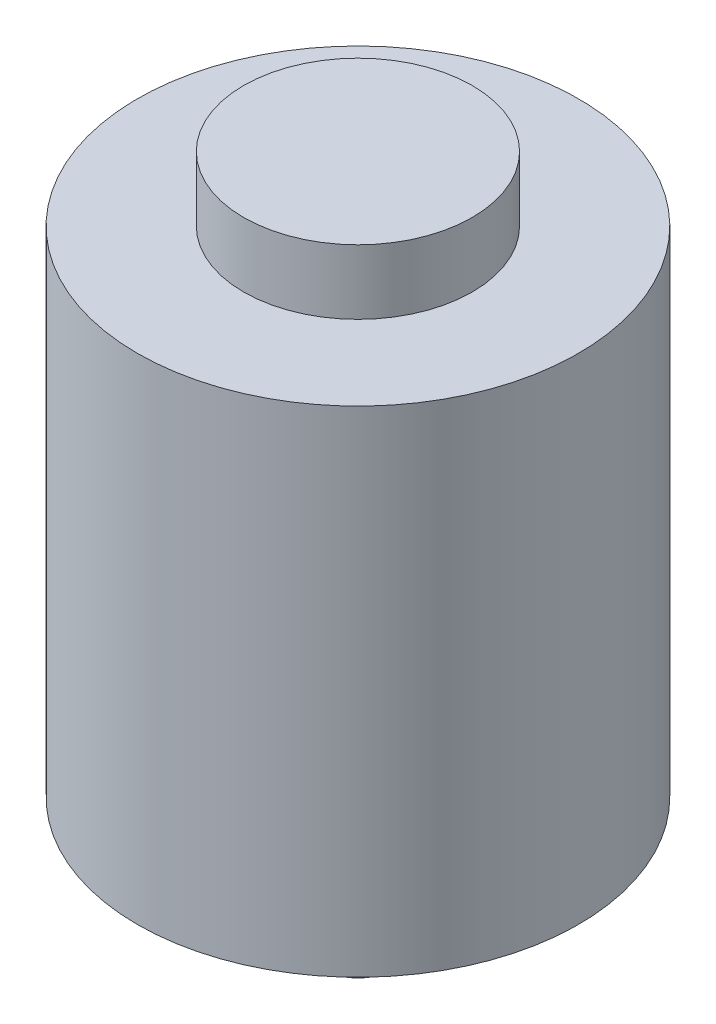
from build123d import *

# Parameters (mm, degrees)
ESBO_O1_R                = 17.075
RESSALTO_EXTRUS_O1_DEPTH = 38.3
ESBO_O2_R                = 8.85
RESSALTO_EXTRUS_O2_DEPTH = 5
ESBO_O3_R                = 4
RESSALTO_EXTRUS_O3_DEPTH = 3
ESBO_O5_R                = 1
RESSALTO_EXTRUS_O4_DEPTH = 7
ESBO_O6_R                = 3
RESSALTO_EXTRUS_O5_DEPTH = 4


with BuildPart() as part:
    # Esboço1 → Ressalto-extrusão1 (new body)
    with BuildSketch(Plane(origin=(0, 0, 0), x_dir=(1, 0, 0), z_dir=(0, 1, 0))):
        with Locations(Location((0, 0, 0), (0, 0, 270))):
            Circle(ESBO_O1_R)
    extrude(amount=RESSALTO_EXTRUS_O1_DEPTH)

    # Esboço2 → Ressalto-extrusão2 (add)
    with BuildSketch(Plane(origin=(0, 38.3, 0), x_dir=(1, 0, 0), z_dir=(0, 1, 0))):
        with Locations(Location((0, 0, 0), (0, 0, 270))):
            Circle(ESBO_O2_R)
    extrude(amount=RESSALTO_EXTRUS_O2_DEPTH)

    # Esboço3 → Ressalto-extrusão3 (add)
    with BuildSketch(Plane.XZ):
        with Locations(Location((0, 0, 0), (0, 0, 270))):
            Circle(ESBO_O3_R)
    extrude(amount=RESSALTO_EXTRUS_O3_DEPTH)

    # Esboço5 → Ressalto-extrusão4 (add)
    with BuildSketch(Plane.XZ.offset(3)):
        with Locations(Location((0, 0, 0), (0, 0, 270))):
            Circle(ESBO_O5_R)
    extrude(amount=RESSALTO_EXTRUS_O4_DEPTH)

    # Esboço6 → Ressalto-extrusão5 (add)
    with BuildSketch(Plane.XZ.offset(10)):
        with Locations(Location((0, 0, 0), (0, 0, 270))):
            Circle(ESBO_O6_R)
    extrude(amount=-RESSALTO_EXTRUS_O5_DEPTH)


solid = part.part
